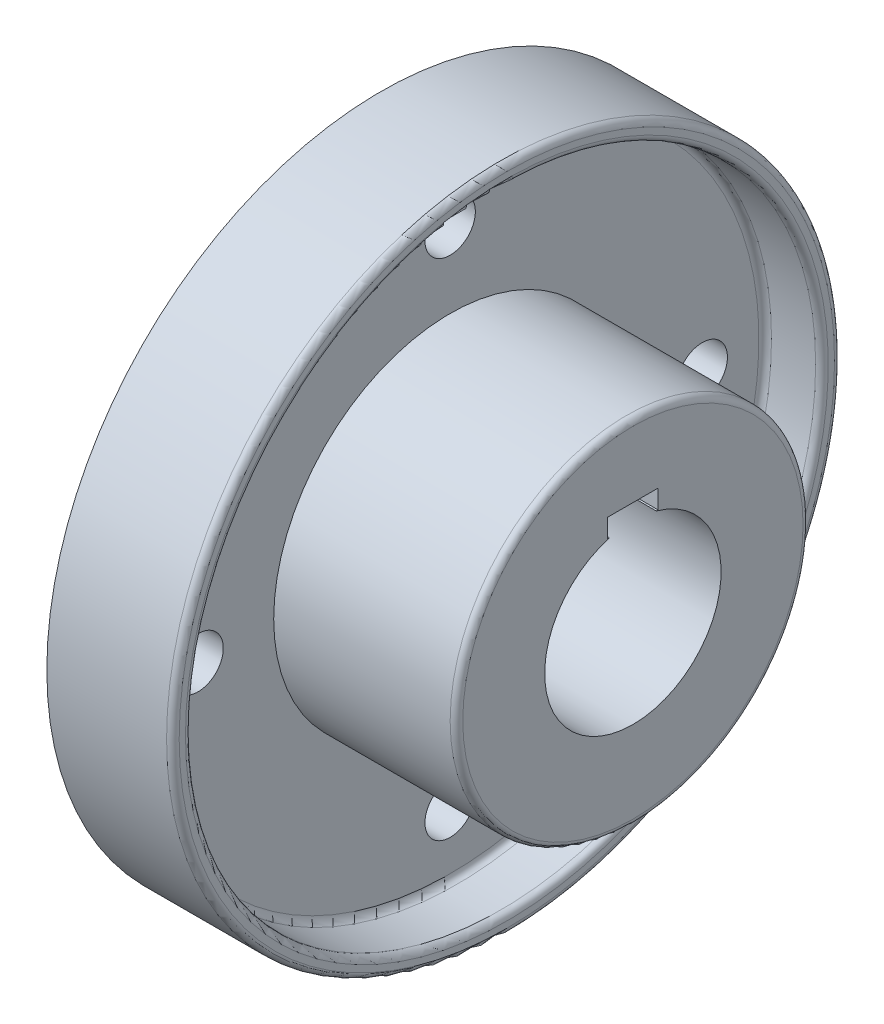
from build123d import *

# Parameters (mm, degrees)
SKETCH3_R           = 46
BOSS_EXTRUDE1_DEPTH = 3
SKETCH2_R           = 28
CUT_EXTRUDE1_DEPTH  = 172.350517945
SKETCH5_R           = 8
CUT_EXTRUDE7_DEPTH  = 170.917627149
CIRPATTERN2_COUNT   = 4
SKETCH7_W           = 16
SKETCH7_H           = 6
CUT_EXTRUDE8_DEPTH  = 172.350517993


with BuildPart() as part:
    # Sketch1 → Revolve1 (revolve)
    with BuildSketch(Plane.XY, mode=Mode.PRIVATE) as revolve1_sk:
        with BuildLine():
            Line((0, 0), (80, 0))
            Line((80, 0), (80, 54))
            ThreePointArc((80, 54), (79.414213562, 55.414213562), (78, 56))
            Line((78, 56), (28.292682927, 56))
            Line((28.292682927, 56), (22, 56))
            Line((22, 56), (22, 98))
            ThreePointArc((22, 98), (22.585786438, 99.414213562), (24, 100))
            Line((24, 100), (38, 100))
            ThreePointArc((38, 100), (39.414213562, 100.585786438), (40, 102))
            Line((40, 102), (40, 104))
            ThreePointArc((40, 104), (39.414213562, 105.414213562), (38, 106))
            Line((38, 106), (0, 106))
            Line((0, 106), (0, 0))
        make_face()
    revolve(revolve1_sk.sketch.rotate(Axis((0, 0, 0), (1, 0, 0)), 90), axis=Axis((0, 0, 0), (1, 0, 0)))

    # Sketch3 → Boss-Extrude1 (add)
    with BuildSketch(Plane.ZY):
        with Locations(Location((0, 0, 0), (0, 0, 180))):
            Circle(SKETCH3_R)
    extrude(amount=BOSS_EXTRUDE1_DEPTH)

    # Sketch2 → Cut-Extrude1 (cut, through all)
    with BuildSketch(Plane(origin=(80, 0, 0), x_dir=(0, 0, -1), z_dir=(1, 0, 0))):
        Circle(SKETCH2_R)
    extrude(amount=-CUT_EXTRUDE1_DEPTH, mode=Mode.SUBTRACT)

    # Sketch5 → Cut-Extrude7 (cut, through all)
    with BuildSketch(Plane.ZY):
        with Locations((0, 80)):
            Circle(SKETCH5_R)
    cut_extrude7 = extrude(amount=-CUT_EXTRUDE7_DEPTH, mode=Mode.SUBTRACT)

    # CirPattern2: Cut-Extrude7 ×4 about axis
    cirpattern2_axis = Axis((0, 0, 0), (1, 0, 0))
    for i in range(1, CIRPATTERN2_COUNT):
        add(cut_extrude7.rotate(cirpattern2_axis, i * 360 / CIRPATTERN2_COUNT), mode=Mode.SUBTRACT)

    # Sketch7 → Cut-Extrude8 (cut, through all)
    with BuildSketch(Plane.ZY.offset(3)):
        with Locations((0, 30)):
            Rectangle(SKETCH7_W, SKETCH7_H)
    extrude(amount=-CUT_EXTRUDE8_DEPTH, mode=Mode.SUBTRACT)


solid = part.part
